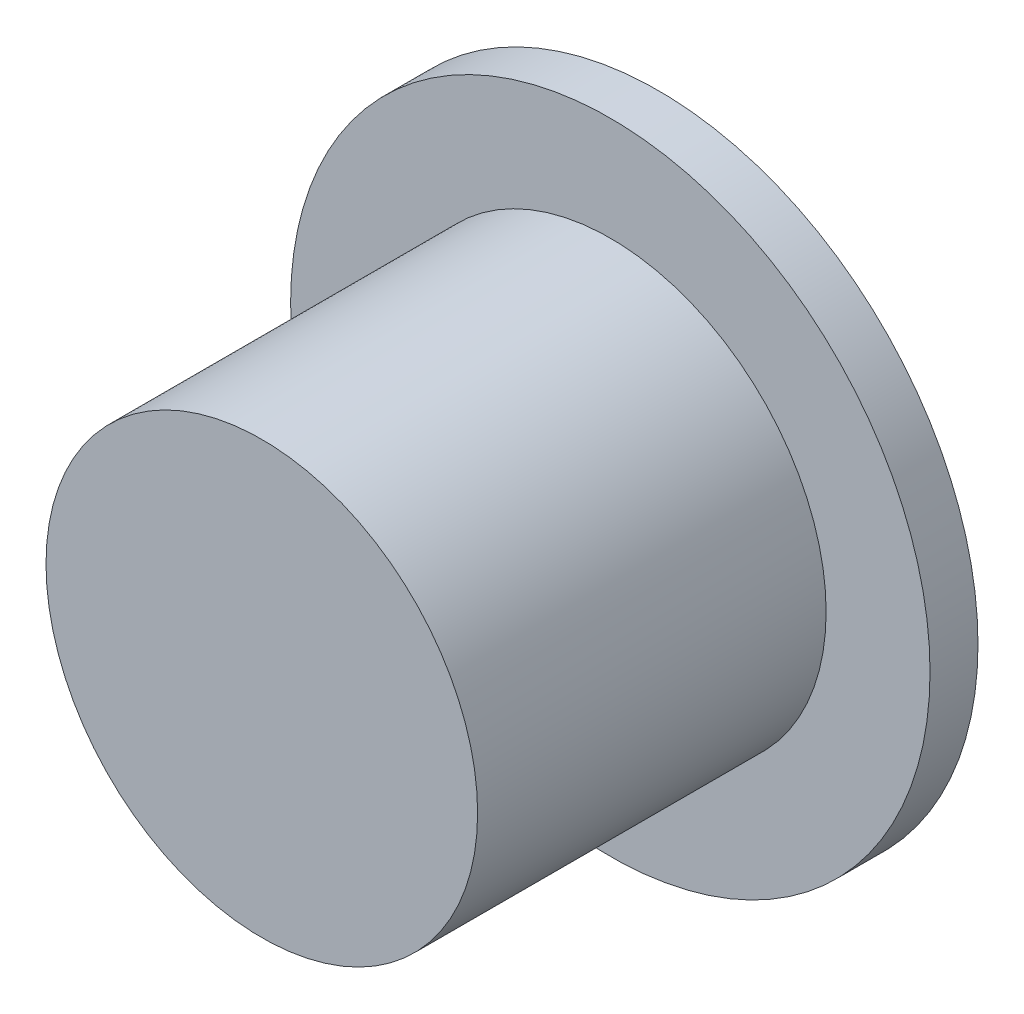
from build123d import *

# Parameters (mm, degrees)
SKETCH_1_R          = 10
EXTRUDE_1_DEPTH     = 1.5
SKETCH_2_R          = 6.75
EXTRUDE_2_DEPTH     = 10.9
SKETCH_3_R          = 4
CUT_EXTRUDE_1_DEPTH = 10


with BuildPart() as part:
    # 草圖1 → 填料-伸長1 (new body)
    with BuildSketch(Plane.XY):
        with Locations((-55.980810071, -89.659090909)):
            Circle(SKETCH_1_R)
    extrude(amount=EXTRUDE_1_DEPTH)

    # 草圖2 → 填料-伸長2 (add)
    with BuildSketch(Plane.XY.offset(1.5)):
        with Locations((-55.980810071, -89.659090909)):
            Circle(SKETCH_2_R)
    extrude(amount=EXTRUDE_2_DEPTH)

    # 草圖3 → 除料-伸長1 (cut)
    with BuildSketch(Plane(origin=(0, 0, 0), x_dir=(-1, 0, 0), z_dir=(0, 0, -1))):
        with Locations((55.980810071, -89.659090909)):
            Circle(SKETCH_3_R)
    extrude(amount=-CUT_EXTRUDE_1_DEPTH, mode=Mode.SUBTRACT)


solid = part.part
